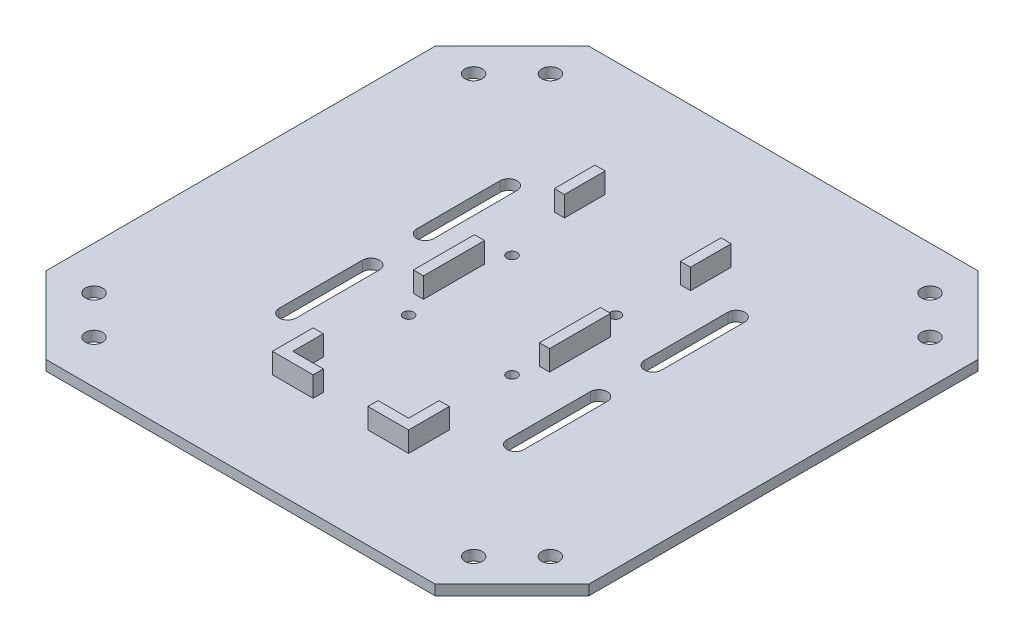
from build123d import *

# Parameters (mm, degrees)
SKETCH1_W                                  = 160
SKETCH1_H                                  = 160
BOSS_EXTRUDE1_DEPTH                        = 3
CUT_EXTRUDE2_REACH                         = 115.177
CUT_EXTRUDE1_REACH                         = 115.177
SKETCH2_R                                  = 2.55
MIRROR2_AT_THE_SECOND_PLANE_COPY_1_REACH   = 115.177
MIRROR2_AT_THE_SECOND_PLANE_COPY_2_REACH   = 115.177
MIRROR2_AT_THE_SECOND_PLANE_COPY_2_SKETC_R = 2.55
CUT_EXTRUDE3_REACH                         = 115.177
SKETCH11_R                                 = 1.525
SKETCH12_W                                 = 3
SKETCH12_H                                 = 12
SKETCH12_H_2                               = 18
BOSS_EXTRUDE2_DEPTH                        = 6
CUT_EXTRUDE4_REACH                         = 115.296
MIRROR4_AT_THE_SECOND_PLANE_COPY_1_REACH   = 115.296


with BuildPart() as part:
    # Sketch1 → Boss-Extrude1 (new body)
    with BuildSketch(Plane(origin=(0, 0, 0), x_dir=(1, 0, 0), z_dir=(0, 1, 0))):
        Rectangle(SKETCH1_W, SKETCH1_H)
    extrude(amount=-BOSS_EXTRUDE1_DEPTH)

    # Sketch6 → Cut-Extrude2 (cut, up to next)
    with BuildSketch(Plane(origin=(0, 0, 0), x_dir=(1, 0, 0), z_dir=(0, 1, 0)), mode=Mode.PRIVATE) as cut_extrude2_sk1:
        Polygon((-80, -57.372583002), (-57.372583002, -80), (-80, -80), align=None)
    cut_extrude2_tool1 = extrude(cut_extrude2_sk1.sketch, amount=-CUT_EXTRUDE2_REACH, mode=Mode.PRIVATE) & part.part
    cut_extrude2 = cut_extrude2_tool1.solids().sort_by_distance((-72.457528, 0, 72.457528))[0]
    add(cut_extrude2, mode=Mode.SUBTRACT)

    # Sketch2 → Cut-Extrude1 (cut, up to next)
    with BuildSketch(Plane(origin=(0, 0, 0), x_dir=(1, 0, 0), z_dir=(0, 1, 0)), mode=Mode.PRIVATE) as cut_extrude1_sk1:
        with Locations(Location((-67.272077939, -55.95836944, 0), (0, 0, 270))):
            Circle(SKETCH2_R)
    cut_extrude1_tool1 = extrude(cut_extrude1_sk1.sketch, amount=-CUT_EXTRUDE1_REACH, mode=Mode.PRIVATE) & part.part
    # Sketch2 → Cut-Extrude1 (cut, up to next)
    with BuildSketch(Plane(origin=(0, 0, 0), x_dir=(1, 0, 0), z_dir=(0, 1, 0)), mode=Mode.PRIVATE) as cut_extrude1_sk2:
        with Locations(Location((-55.95836944, -67.272077939, 0), (0, 0, 270))):
            Circle(SKETCH2_R)
    cut_extrude1_tool2 = extrude(cut_extrude1_sk2.sketch, amount=-CUT_EXTRUDE1_REACH, mode=Mode.PRIVATE) & part.part
    cut_extrude1_1 = cut_extrude1_tool1.solids().sort_by_distance((-67.272078, 0, 55.958369))[0]
    add(cut_extrude1_1, mode=Mode.SUBTRACT)
    cut_extrude1_2 = cut_extrude1_tool2.solids().sort_by_distance((-55.958369, 0, 67.272078))[0]
    add(cut_extrude1_2, mode=Mode.SUBTRACT)
    cut_extrude1 = cut_extrude1_1 + cut_extrude1_2  # Cut-Extrude1 as one shape, for the pattern or mirror that repeats it

    # Mirror2: Cut-Extrude2, Cut-Extrude1 across plane
    add(cut_extrude2.mirror(Plane(origin=(0, 0, 0), x_dir=(0, 0, 1), z_dir=(1, 0, 0))), mode=Mode.SUBTRACT)
    add(cut_extrude1.mirror(Plane(origin=(0, 0, 0), x_dir=(0, 0, 1), z_dir=(1, 0, 0))), mode=Mode.SUBTRACT)

    # Mirror2 at the second plane: Cut-Extrude2, Cut-Extrude1 across plane
    add(cut_extrude2.mirror(Plane.XY), mode=Mode.SUBTRACT)
    add(cut_extrude1.mirror(Plane.XY), mode=Mode.SUBTRACT)

    # Mirror2 at the second plane copy 1 sketc → Mirror2 at the second plane copy 1 (cut, up to next)
    with BuildSketch(Plane(origin=(0, 0, 0), x_dir=(-1, 0, 0), z_dir=(0, 1, 0)), mode=Mode.PRIVATE) as mirror2_at_the_second_plane_copy_1_sk1:
        Polygon((-80, -57.372583002), (-57.372583002, -80), (-80, -80), align=None)
    mirror2_at_the_second_plane_copy_1_tool1 = extrude(mirror2_at_the_second_plane_copy_1_sk1.sketch, amount=-MIRROR2_AT_THE_SECOND_PLANE_COPY_1_REACH, mode=Mode.PRIVATE) & part.part
    add(mirror2_at_the_second_plane_copy_1_tool1.solids().sort_by_distance((72.457528, 0, -72.457528))[0], mode=Mode.SUBTRACT)

    # Mirror2 at the second plane copy 2 sketc → Mirror2 at the second plane copy 2 (cut, up to next)
    with BuildSketch(Plane(origin=(0, 0, 0), x_dir=(-1, 0, 0), z_dir=(0, 1, 0)), mode=Mode.PRIVATE) as mirror2_at_the_second_plane_copy_2_sk1:
        with Locations(Location((-67.272077939, -55.95836944, 0), (0, 0, 270))):
            Circle(MIRROR2_AT_THE_SECOND_PLANE_COPY_2_SKETC_R)
    mirror2_at_the_second_plane_copy_2_tool1 = extrude(mirror2_at_the_second_plane_copy_2_sk1.sketch, amount=-MIRROR2_AT_THE_SECOND_PLANE_COPY_2_REACH, mode=Mode.PRIVATE) & part.part
    # Mirror2 at the second plane copy 2 sketc → Mirror2 at the second plane copy 2 (cut, up to next)
    with BuildSketch(Plane(origin=(0, 0, 0), x_dir=(-1, 0, 0), z_dir=(0, 1, 0)), mode=Mode.PRIVATE) as mirror2_at_the_second_plane_copy_2_sk2:
        with Locations(Location((-55.95836944, -67.272077939, 0), (0, 0, 270))):
            Circle(MIRROR2_AT_THE_SECOND_PLANE_COPY_2_SKETC_R)
    mirror2_at_the_second_plane_copy_2_tool2 = extrude(mirror2_at_the_second_plane_copy_2_sk2.sketch, amount=-MIRROR2_AT_THE_SECOND_PLANE_COPY_2_REACH, mode=Mode.PRIVATE) & part.part
    add(mirror2_at_the_second_plane_copy_2_tool1.solids().sort_by_distance((67.272078, 0, -55.958369))[0], mode=Mode.SUBTRACT)
    add(mirror2_at_the_second_plane_copy_2_tool2.solids().sort_by_distance((55.958369, 0, -67.272078))[0], mode=Mode.SUBTRACT)

    # Sketch11 → Cut-Extrude3 (cut, up to next)
    with BuildSketch(Plane(origin=(0, 0, 0), x_dir=(1, 0, 0), z_dir=(0, 1, 0)), mode=Mode.PRIVATE) as cut_extrude3_sk1:
        with Locations(Location((-15.25, 15.25, 0), (0, 0, 270))):
            Circle(SKETCH11_R)
    cut_extrude3_tool1 = extrude(cut_extrude3_sk1.sketch, amount=-CUT_EXTRUDE3_REACH, mode=Mode.PRIVATE) & part.part
    # Sketch11 → Cut-Extrude3 (cut, up to next)
    with BuildSketch(Plane(origin=(0, 0, 0), x_dir=(1, 0, 0), z_dir=(0, 1, 0)), mode=Mode.PRIVATE) as cut_extrude3_sk2:
        with Locations(Location((15.25, 15.25, 0), (0, 0, 270))):
            Circle(SKETCH11_R)
    cut_extrude3_tool2 = extrude(cut_extrude3_sk2.sketch, amount=-CUT_EXTRUDE3_REACH, mode=Mode.PRIVATE) & part.part
    # Sketch11 → Cut-Extrude3 (cut, up to next)
    with BuildSketch(Plane(origin=(0, 0, 0), x_dir=(1, 0, 0), z_dir=(0, 1, 0)), mode=Mode.PRIVATE) as cut_extrude3_sk3:
        with Locations(Location((15.25, -15.25, 0), (0, 0, 270))):
            Circle(SKETCH11_R)
    cut_extrude3_tool3 = extrude(cut_extrude3_sk3.sketch, amount=-CUT_EXTRUDE3_REACH, mode=Mode.PRIVATE) & part.part
    # Sketch11 → Cut-Extrude3 (cut, up to next)
    with BuildSketch(Plane(origin=(0, 0, 0), x_dir=(1, 0, 0), z_dir=(0, 1, 0)), mode=Mode.PRIVATE) as cut_extrude3_sk4:
        with Locations(Location((-15.25, -15.25, 0), (0, 0, 270))):
            Circle(SKETCH11_R)
    cut_extrude3_tool4 = extrude(cut_extrude3_sk4.sketch, amount=-CUT_EXTRUDE3_REACH, mode=Mode.PRIVATE) & part.part
    add(cut_extrude3_tool1.solids().sort_by_distance((-15.25, 0, -15.25))[0], mode=Mode.SUBTRACT)
    add(cut_extrude3_tool2.solids().sort_by_distance((15.25, 0, -15.25))[0], mode=Mode.SUBTRACT)
    add(cut_extrude3_tool3.solids().sort_by_distance((15.25, 0, 15.25))[0], mode=Mode.SUBTRACT)
    add(cut_extrude3_tool4.solids().sort_by_distance((-15.25, 0, 15.25))[0], mode=Mode.SUBTRACT)

    # Sketch12 → Boss-Extrude2 (add)
    with BuildSketch(Plane(origin=(0, 0, 0), x_dir=(1, 0, 0), z_dir=(0, 1, 0))):
        Polygon((-17.075, -47.55), (-8.075, -47.55), (-8.075, -50.55), (-20.075, -50.55), (-20.075, -38.55), (-17.075, -38.55), align=None)
        with Locations((-18.575, 38.55)):
            Rectangle(SKETCH12_W, SKETCH12_H)
        with Locations((-18.575, 0)):
            Rectangle(SKETCH12_W, SKETCH12_H_2)
    boss_extrude2 = extrude(amount=BOSS_EXTRUDE2_DEPTH)

    # Mirror3: Boss-Extrude2 across plane
    add(boss_extrude2.mirror(Plane(origin=(0, 0, 0), x_dir=(0, 0, 1), z_dir=(1, 0, 0))))

    # Sketch13 → Cut-Extrude4 (cut, up to next)
    with BuildSketch(Plane(origin=(0, 0, 0), x_dir=(1, 0, 0), z_dir=(0, 1, 0)), mode=Mode.PRIVATE) as cut_extrude4_sk1:
        with BuildLine():
            Line((-31.075, 32.55), (-31.075, 8))
            ThreePointArc((-31.075, 8), (-33.575, 5.5), (-36.075, 8))
            Line((-36.075, 8), (-36.075, 32.55))
            ThreePointArc((-36.075, 32.55), (-33.575, 35.05), (-31.075, 32.55))
        make_face()
    cut_extrude4_tool1 = extrude(cut_extrude4_sk1.sketch, amount=-CUT_EXTRUDE4_REACH, mode=Mode.PRIVATE) & part.part
    cut_extrude4 = cut_extrude4_tool1.solids().sort_by_distance((-33.575, 0, -20.275))[0]
    add(cut_extrude4, mode=Mode.SUBTRACT)

    # Mirror4: Cut-Extrude4 across plane
    add(cut_extrude4.mirror(Plane(origin=(0, 0, 0), x_dir=(0, 0, 1), z_dir=(1, 0, 0))), mode=Mode.SUBTRACT)

    # Mirror4 at the second plane: Cut-Extrude4 across plane
    add(cut_extrude4.mirror(Plane.XY), mode=Mode.SUBTRACT)

    # Mirror4 at the second plane copy 1 sketc → Mirror4 at the second plane copy 1 (cut, up to next)
    with BuildSketch(Plane(origin=(0, 0, 0), x_dir=(-1, 0, 0), z_dir=(0, 1, 0)), mode=Mode.PRIVATE) as mirror4_at_the_second_plane_copy_1_sk1:
        with BuildLine():
            Line((-31.075, 32.55), (-31.075, 8))
            ThreePointArc((-31.075, 8), (-33.575, 5.5), (-36.075, 8))
            Line((-36.075, 8), (-36.075, 32.55))
            ThreePointArc((-36.075, 32.55), (-33.575, 35.05), (-31.075, 32.55))
        make_face()
    mirror4_at_the_second_plane_copy_1_tool1 = extrude(mirror4_at_the_second_plane_copy_1_sk1.sketch, amount=-MIRROR4_AT_THE_SECOND_PLANE_COPY_1_REACH, mode=Mode.PRIVATE) & part.part
    add(mirror4_at_the_second_plane_copy_1_tool1.solids().sort_by_distance((33.575, 0, 20.275))[0], mode=Mode.SUBTRACT)


solid = part.part
